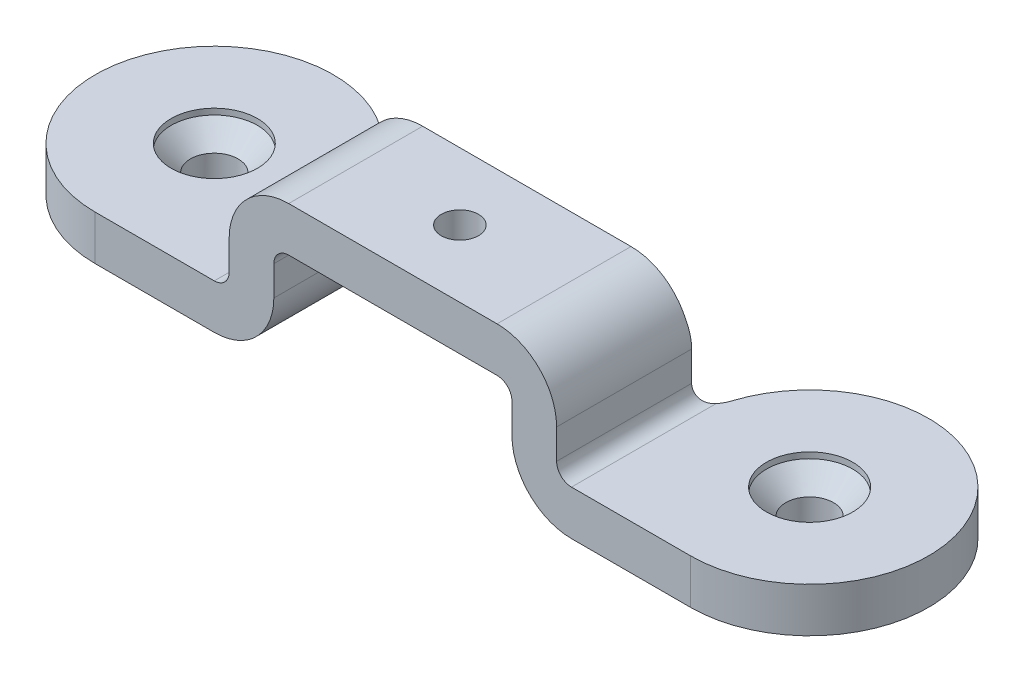
from build123d import *

# Parameters (mm, degrees)
BOSS_EXTRU_1_DEPTH           = 10
ENL_V_MAT_EXTRU_1_DEPTH      = 31.789608707
ENL_V_MAT_EXTRU_1_DEPTH_BACK = 31.789608707
ESQUISSE2_OUTSIDE_W          = 69.818
ESQUISSE2_OUTSIDE_H          = 23.818
ESQUISSE3_R                  = 4
BOSS_EXTRU_2_DEPTH           = 0.3
TROU_TARAUD_M31_D            = 2.5


with BuildPart() as part:
    # Esquisse1 → Boss.-Extru.1 (new body)
    with BuildSketch(Plane(origin=(0, 0, 0), x_dir=(1, 0, 0), z_dir=(0, 1, 0))):
        with BuildLine():
            Line((-20, -7.99999973), (20, -7.99999973))
            ThreePointArc((20, -7.99999973), (26.449806199, 4.732864097), (12.368486389, 2.40000027))
            ThreePointArc((12.368486389, 2.40000027), (11.643823942, 1.38754872), (10.460607986, 1.00000027))
            Line((10.460607986, 1.00000027), (-10.460607986, 1.00000027))
            ThreePointArc((-10.460607986, 1.00000027), (-11.643823942, 1.38754872), (-12.368486389, 2.40000027))
            ThreePointArc((-12.368486389, 2.40000027), (-26.449806199, 4.732864097), (-20, -7.99999973))
        make_face()
    extrude(amount=BOSS_EXTRU_1_DEPTH)

    # Esquisse2 outside → Enlèv. mat.-Extru.1 (cut, two sides: drawn at the far end of the back side and taken through both)
    with BuildSketch(Plane.XY.offset(-ENL_V_MAT_EXTRU_1_DEPTH_BACK)):
        with Locations((0, 5)):
            Rectangle(ESQUISSE2_OUTSIDE_W, ESQUISSE2_OUTSIDE_H)
        with BuildLine():
            Line((7, 10), (-7, 10))
            ThreePointArc((-7, 10), (-9.828427125, 8.828427125), (-11, 6))
            Line((-11, 6), (-11, 4))
            ThreePointArc((-11, 4), (-11.292893219, 3.292893219), (-12, 3))
            Line((-12, 3), (-28, 3))
            Line((-28, 3), (-28, 0))
            Line((-28, 0), (-12, 0))
            ThreePointArc((-12, 0), (-9.171572875, 1.171572875), (-8, 4))
            Line((-8, 4), (-8, 6))
            ThreePointArc((-8, 6), (-7.707106781, 6.707106781), (-7, 7))
            Line((-7, 7), (7, 7))
            ThreePointArc((7, 7), (7.707106781, 6.707106781), (8, 6))
            Line((8, 6), (8, 4))
            ThreePointArc((8, 4), (9.171572875, 1.171572875), (12, 0))
            Line((12, 0), (28, 0))
            Line((28, 0), (28, 3))
            Line((28, 3), (12, 3))
            ThreePointArc((12, 3), (11.292893219, 3.292893219), (11, 4))
            Line((11, 4), (11, 6))
            ThreePointArc((11, 6), (9.828427125, 8.828427125), (7, 10))
        make_face(mode=Mode.SUBTRACT)
    extrude(amount=ENL_V_MAT_EXTRU_1_DEPTH + ENL_V_MAT_EXTRU_1_DEPTH_BACK, mode=Mode.SUBTRACT)

    # Esquisse3 → Boss.-Extru.2 (add)
    with BuildSketch(Plane.XZ):
        with Locations(Location((20, -2.7e-07, 0), (0, 0, 270))):
            Circle(ESQUISSE3_R)
    boss_extru_2 = extrude(amount=BOSS_EXTRU_2_DEPTH)

    # Esquisse4 → Fraisage pour vis à tête fraisée à 6 pans creux M31 (revolve, cut)
    with BuildSketch(Plane(origin=(20, 3, -2.7e-07), x_dir=(0, 0, 1), z_dir=(1, 0, 0))):
        Polygon((0, 0), (0, 3.3), (1.6, 3.3), (1.6, 1.7), (2.9, 0.4), (2.9, 0), align=None)
    fraisage_pour_vis_t_te_frais_e_6_pan = revolve(axis=Axis((20, 9.35, -2.7e-07), (0, -1, 0)), mode=Mode.SUBTRACT)

    # Trou taraudé M31 (through all)
    with Locations(Plane(origin=(0, 10, 0), x_dir=(1, 0, 0), z_dir=(0, 1, 0))):
        with Locations((0, -3.5)):
            Hole(TROU_TARAUD_M31_D / 2)

    # Symétrie1: Boss.-Extru.2, Fraisage pour vis à tête fraisée à 6 pans creux M31 across plane
    add(boss_extru_2.mirror(Plane(origin=(0, 0, 0), x_dir=(0, 0, 1), z_dir=(1, 0, 0))))
    add(fraisage_pour_vis_t_te_frais_e_6_pan.mirror(Plane(origin=(0, 0, 0), x_dir=(0, 0, 1), z_dir=(1, 0, 0))), mode=Mode.SUBTRACT)


solid = part.part
